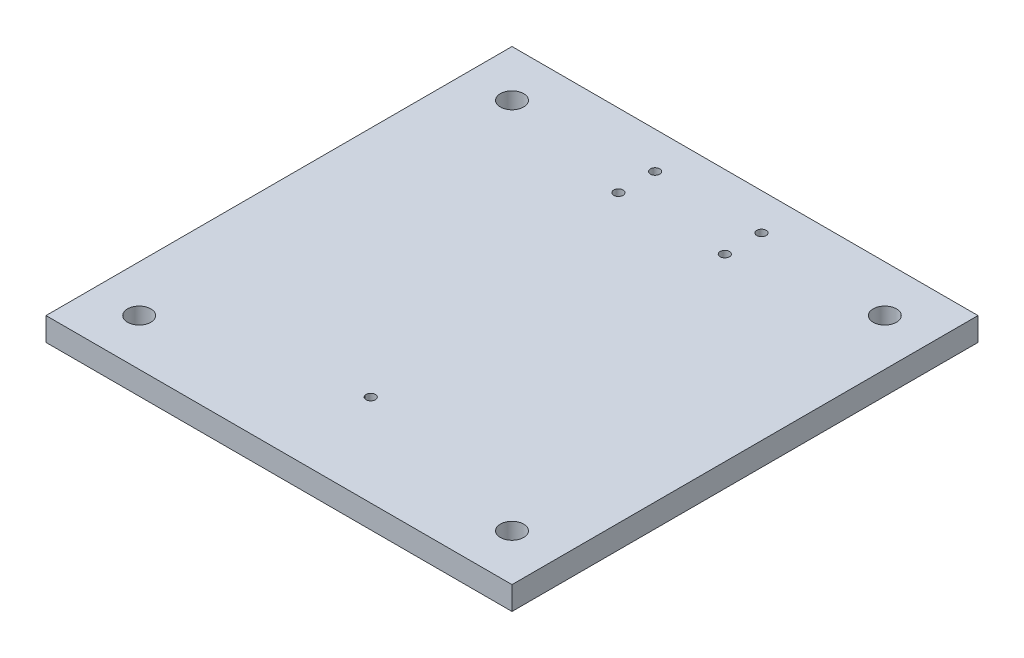
from build123d import *

# Parameters (mm, degrees)
SKETCH1_W           = 127
SKETCH1_H           = 127
SKETCH1_R           = 1.27
SKETCH1_R_2         = 3.175
BOSS_EXTRUDE1_DEPTH = 6.35


with BuildPart() as part:
    # Sketch1 → Boss-Extrude1 (new body)
    with BuildSketch(Plane(origin=(0, 0, 0), x_dir=(1, 0, 0), z_dir=(0, 1, 0))):
        with Locations((25.4, -6.35)):
            Rectangle(SKETCH1_W, SKETCH1_H)
        with Locations(Location((10.9, 47.15, 0), (0, 0, 270))):
            Circle(SKETCH1_R, mode=Mode.SUBTRACT)
        with Locations(Location((39.9, 47.15, 0), (0, 0, 270))):
            Circle(SKETCH1_R, mode=Mode.SUBTRACT)
        with Locations(Location((25.4, -44.85, 0), (0, 0, 270))):
            Circle(SKETCH1_R, mode=Mode.SUBTRACT)
        with Locations(Location((10.9, 37.15, 0), (0, 0, 270))):
            Circle(SKETCH1_R, mode=Mode.SUBTRACT)
        with Locations(Location((39.9, 37.15, 0), (0, 0, 270))):
            Circle(SKETCH1_R, mode=Mode.SUBTRACT)
        with Locations(Location((-25.4, 44.45, 0), (0, 0, 270))):
            Circle(SKETCH1_R_2, mode=Mode.SUBTRACT)
        with Locations(Location((76.2, 44.45, 0), (0, 0, 270))):
            Circle(SKETCH1_R_2, mode=Mode.SUBTRACT)
        with Locations(Location((76.2, -57.15, 0), (0, 0, 270))):
            Circle(SKETCH1_R_2, mode=Mode.SUBTRACT)
        with Locations(Location((-25.4, -57.15, 0), (0, 0, 270))):
            Circle(SKETCH1_R_2, mode=Mode.SUBTRACT)
    extrude(amount=BOSS_EXTRUDE1_DEPTH)


solid = part.part
